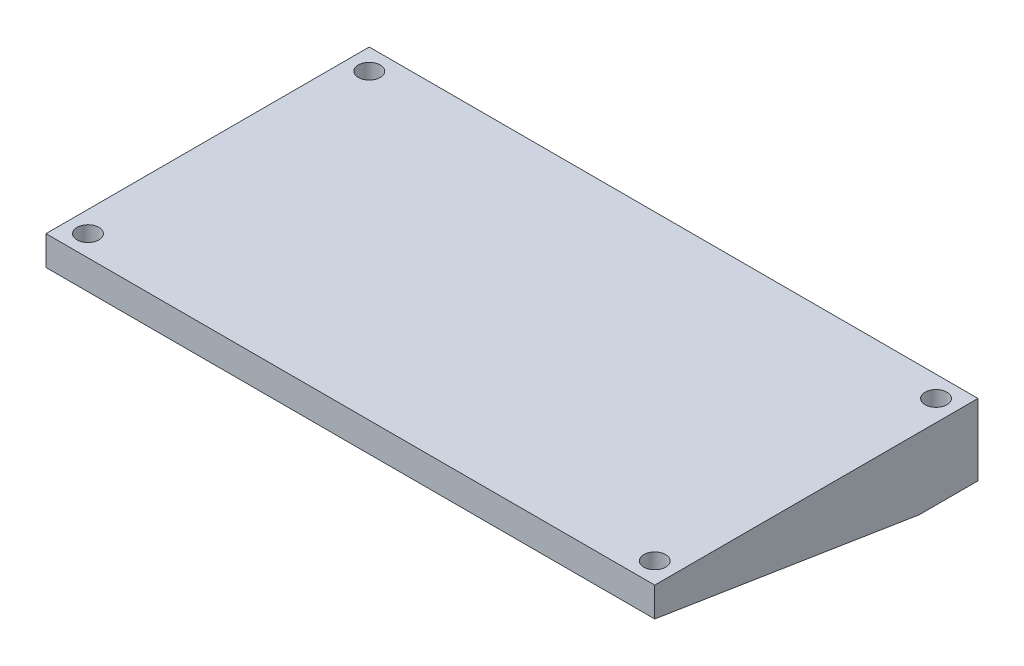
from build123d import *

# Parameters (mm, degrees)
SKETCH5_W           = 145
SKETCH5_H           = 77
BOSS_EXTRUDE2_DEPTH = 17
CHAMFER2_SIZE       = 63
CHAMFER2_SIZE2      = 10
SKETCH1_R           = 2.6
CUT_EXTRUDE1_DEPTH  = 5


with BuildPart() as part:
    # Sketch5 → Boss-Extrude2 (new body)
    with BuildSketch(Plane(origin=(0, 0, 0), x_dir=(1, 0, 0), z_dir=(0, 1, 0))):
        with Locations((72.5, 38.5)):
            Rectangle(SKETCH5_W, SKETCH5_H)
    extrude(amount=BOSS_EXTRUDE2_DEPTH)

    # Chamfer2
    chamfer2_edges = [part.edges().sort_by_distance(p)[0] for p in [
        (72.5, 0, 0),
    ]]
    chamfer2_side = [part.faces().sort_by_distance(p)[0] for p in [
        (72.5, 0, -38.5),
    ]]
    chamfer(chamfer2_edges, length=CHAMFER2_SIZE, length2=CHAMFER2_SIZE2, reference=chamfer2_side[0])

    # Sketch1 → Cut-Extrude1 (cut)
    with BuildSketch(Plane(origin=(0, 17, 0), x_dir=(1, 0, 0), z_dir=(0, 1, 0))):
        with Locations(Location((5, 72, 0), (0, 0, 270))):
            Circle(SKETCH1_R)
        with Locations(Location((5, 5, 0), (0, 0, 270))):
            Circle(SKETCH1_R)
        with Locations(Location((140, 5, 0), (0, 0, 270))):
            Circle(SKETCH1_R)
        with Locations(Location((140, 72, 0), (0, 0, 270))):
            Circle(SKETCH1_R)
    extrude(amount=-CUT_EXTRUDE1_DEPTH, mode=Mode.SUBTRACT)


solid = part.part
